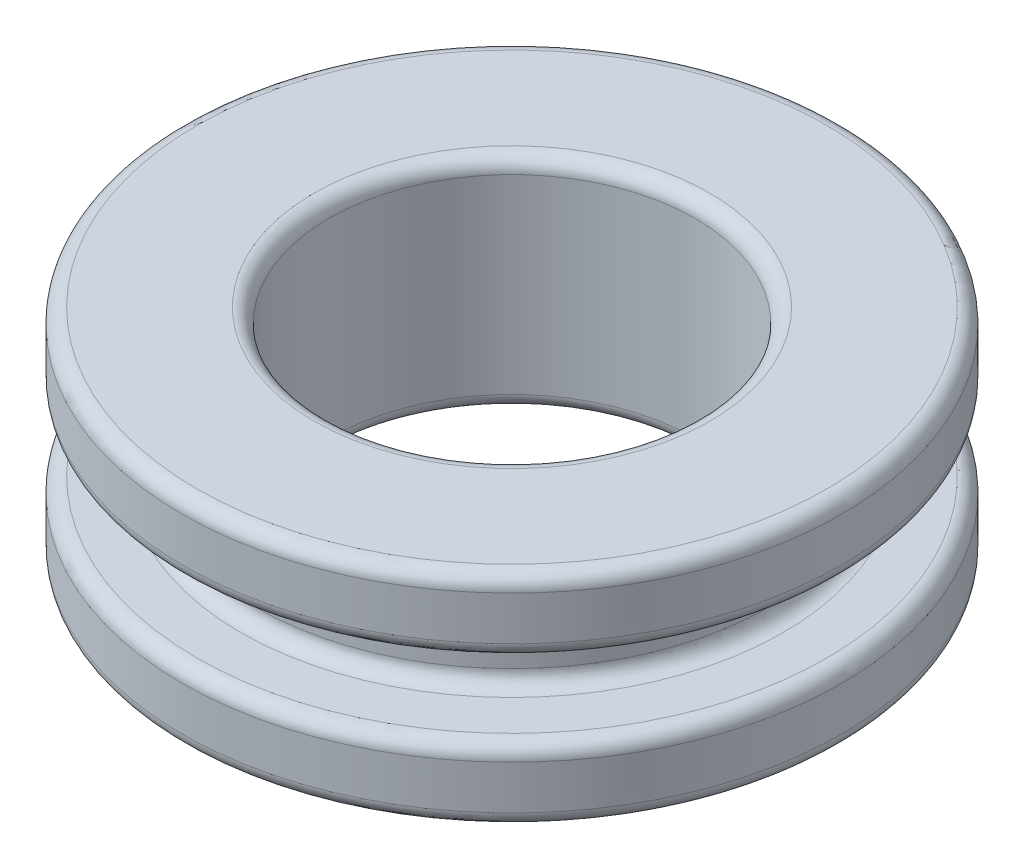
from build123d import *

# Parameters (mm, degrees)
FILLET2_R = 0.635


with BuildPart() as part:
    # Sketch1 → Revolve1 (revolve)
    with BuildSketch(Plane.XY, mode=Mode.PRIVATE) as revolve1_sk:
        Polygon((7.9375, 0), (14.2875, 0), (14.2875, 3.175), (11.1125, 3.175), (11.1125, 6.35), (14.2875, 6.35), (14.2875, 9.525), (7.9375, 9.525), align=None)
    revolve(revolve1_sk.sketch.rotate(Axis((0, 0, 0), (0, 1, 0)), 90), axis=Axis((0, 0, 0), (0, 1, 0)))

    # Fillet2
    fillet2_edges = [part.edges().sort_by_distance(p)[0] for p in [
        (0, 0, 7.9375),
        (0, 0, 14.2875),
        (0, 3.175, 14.2875),
        (0, 3.175, 11.1125),
        (0, 6.35, 11.1125),
        (0, 6.35, 14.2875),
        (0, 9.525, 14.2875),
        (0, 9.525, 7.9375),
    ]]
    fillet(fillet2_edges, radius=FILLET2_R)


solid = part.part
